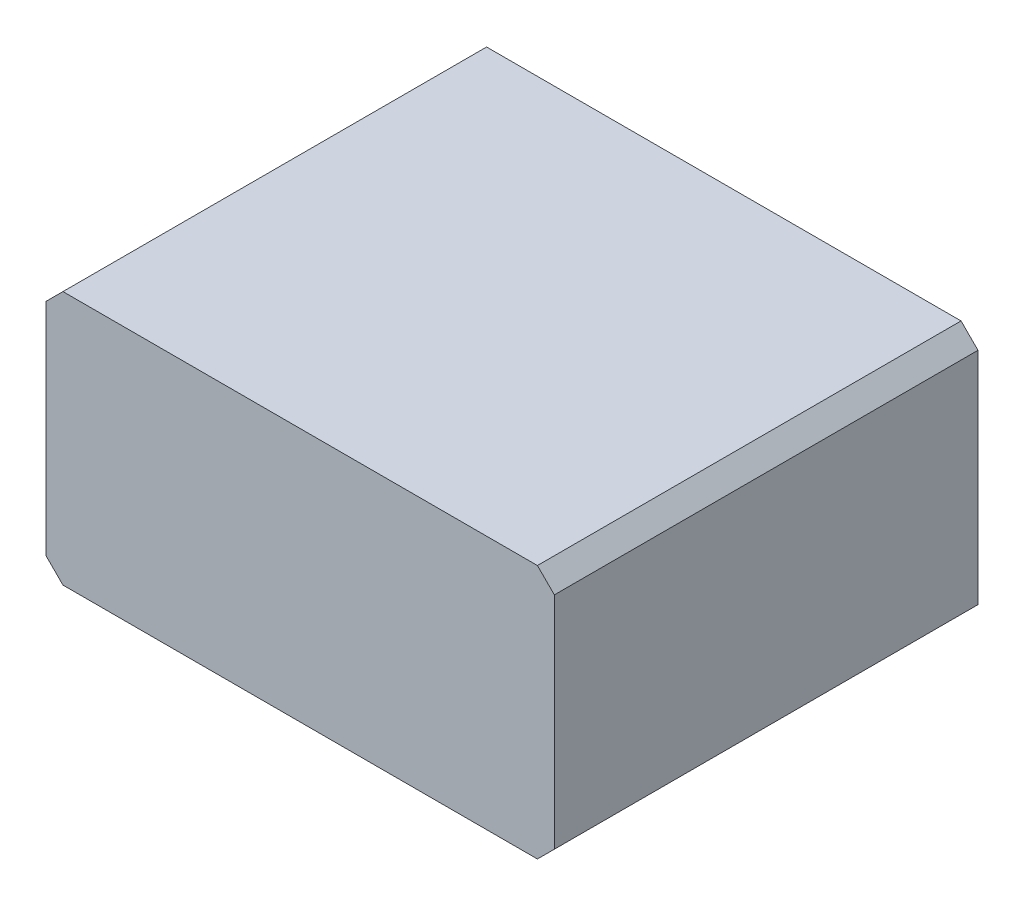
from build123d import *

# Parameters (mm, degrees)
SKETCH_1_W      = 60
SKETCH_1_H      = 30
EXTRUDE_1_DEPTH = 25
CHAMFER_1_SIZE  = 2


with BuildPart() as part:
    # 草图1 → 凸台-拉伸1 (new, symmetric)
    with BuildSketch(Plane.XY):
        Rectangle(SKETCH_1_W, SKETCH_1_H)
    extrude(amount=EXTRUDE_1_DEPTH, both=True)

    # 倒角1
    chamfer_1_edges = [part.edges().sort_by_distance(p)[0] for p in [
        (30, -15, 0),
        (-30, -15, 0),
        (-30, 15, 0),
        (30, 15, 0),
    ]]
    chamfer(chamfer_1_edges, length=CHAMFER_1_SIZE)


solid = part.part
